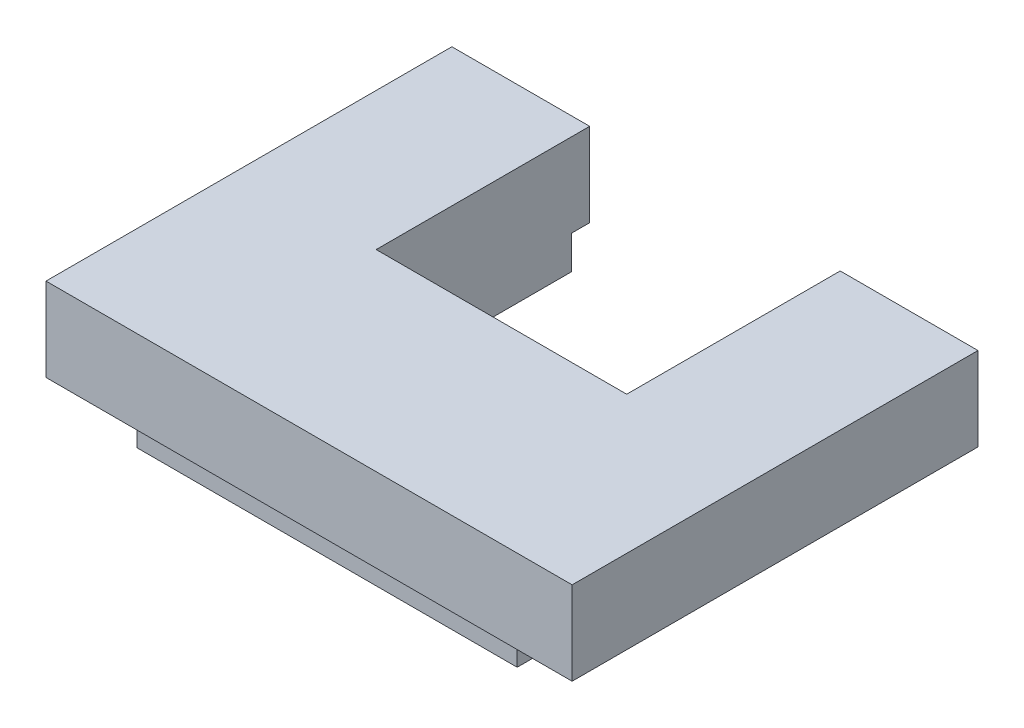
from build123d import *

# Parameters (mm, degrees)
SKETCH1_W           = 800.1
SKETCH1_H           = 617.22
BOSS_EXTRUDE1_DEPTH = 304.8
SKETCH3_W           = 800.1
SKETCH3_H           = 617.22
SKETCH3_W_2         = 578.099229306
SKETCH3_H_2         = 562.360466338
CUT_EXTRUDE1_DEPTH  = 177.8
SKETCH5_W           = 578.099229306
SKETCH5_H           = 127
CUT_EXTRUDE3_DEPTH  = 776.110031957
SKETCH6_W           = 381
SKETCH6_H           = 324.666103145
CUT_EXTRUDE4_DEPTH  = 536.623911527


with BuildPart() as part:
    # Sketch1 → Boss-Extrude1 (new body)
    with BuildSketch(Plane(origin=(0, 0, 0), x_dir=(1, 0, 0), z_dir=(0, 1, 0))):
        Rectangle(SKETCH1_W, SKETCH1_H)
    extrude(amount=-BOSS_EXTRUDE1_DEPTH)

    # Sketch3 → Cut-Extrude1 (cut)
    with BuildSketch(Plane.XZ.offset(304.8)):
        Rectangle(SKETCH3_W, SKETCH3_H)
        Rectangle(SKETCH3_W_2, SKETCH3_H_2, mode=Mode.SUBTRACT)
    extrude(amount=-CUT_EXTRUDE1_DEPTH, mode=Mode.SUBTRACT)

    # Sketch5 → Cut-Extrude3 (cut, through all)
    with BuildSketch(Plane.XY.offset(281.180233169)):
        with Locations((0, -241.3)):
            Rectangle(SKETCH5_W, SKETCH5_H)
    extrude(amount=-CUT_EXTRUDE3_DEPTH, mode=Mode.SUBTRACT)

    # Sketch6 → Cut-Extrude4 (cut, through all)
    with BuildSketch(Plane(origin=(0, 0, 0), x_dir=(1, 0, 0), z_dir=(0, 1, 0))):
        with Locations((0, 146.276948428)):
            Rectangle(SKETCH6_W, SKETCH6_H)
    extrude(amount=-CUT_EXTRUDE4_DEPTH, mode=Mode.SUBTRACT)


solid = part.part
